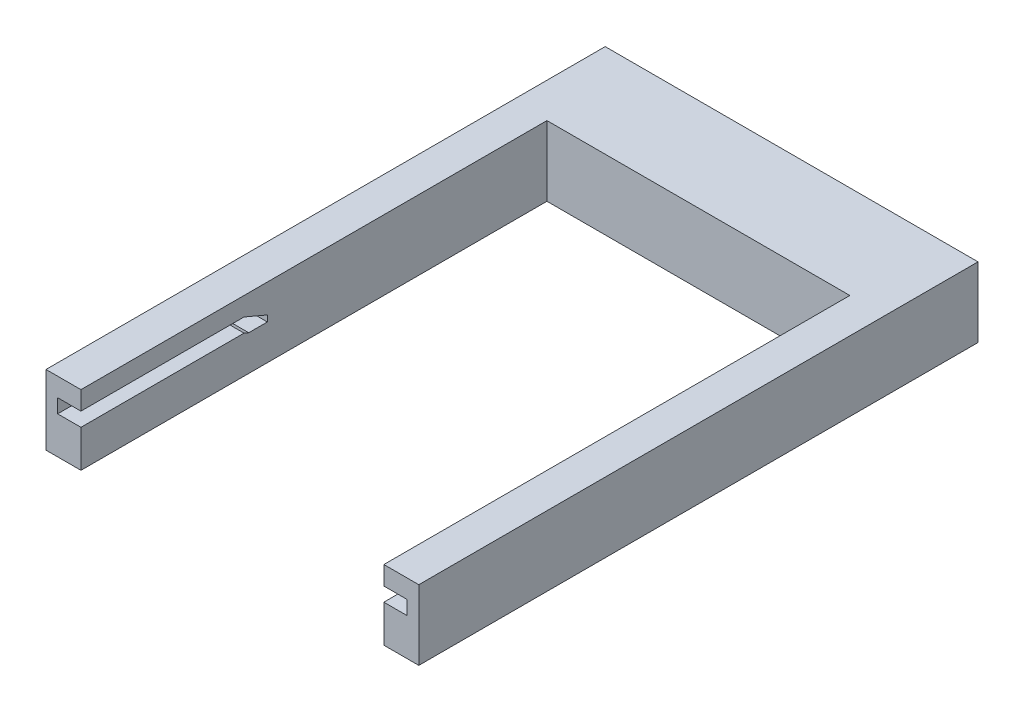
from build123d import *

# Parameters (mm, degrees)
BOSS_EXTRUDE1_DEPTH = 15
CUT_EXTRUDE1_DEPTH  = 37.5


with BuildPart() as part:
    # Sketch1 → Boss-Extrude1 (new body)
    with BuildSketch(Plane(origin=(0, 0, 0), x_dir=(1, 0, 0), z_dir=(0, 1, 0))):
        Polygon((32.5, -60), (40, -60), (40, 60), (-40, 60), (-40, -60), (-32.5, -60), (-32.5, 40), (32.5, 40), align=None)
    extrude(amount=BOSS_EXTRUDE1_DEPTH)

    # Sketch2 → Cut-Extrude1 (cut, symmetric)
    with BuildSketch(Plane(origin=(0, 0, 0), x_dir=(0, 0, -1), z_dir=(1, 0, 0))):
        Polygon((-60, 11), (-25, 11), (-20, 8.877625919), (-20, 7.575525184), (-24, 7.575525184), (-25, 8), (-60, 8), align=None)
    extrude(amount=CUT_EXTRUDE1_DEPTH, both=True, mode=Mode.SUBTRACT)


solid = part.part
